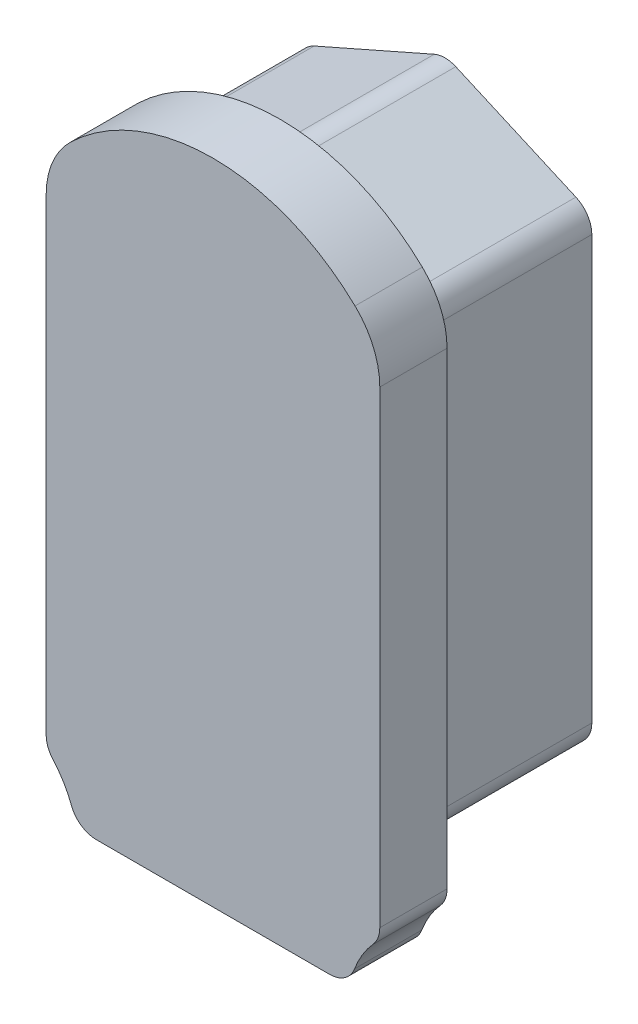
from build123d import *

# Parameters (mm, degrees)
SKICA1_W                 = 12.5
SKICA1_H                 = 24.3
P_IDAT_VYSUNUT_M1_DEPTH  = 4.52
ODEBRAT_VYSUNUT_M1_DEPTH = 4.52
ODEBRAT_VYSUNUT_M2_DEPTH = 4.52
ZAOBLIT1_R               = 1
ZAOBLIT2_R               = 3
P_IDAT_VYSUNUT_M2_DEPTH  = 6.174
ZAOBLIT4_R               = 1
ODEBRAT_VYSUNUT_M3_DEPTH = 2


with BuildPart() as part:
    # Skica1 → Přidat vysunutím1 (new body)
    with BuildSketch(Plane.XY):
        Rectangle(SKICA1_W, SKICA1_H)
    extrude(amount=P_IDAT_VYSUNUT_M1_DEPTH)

    # Skica2 → Odebrat vysunutím1 (cut)
    with BuildSketch(Plane(origin=(0, 0, 0), x_dir=(-1, 0, 0), z_dir=(0, 0, -1))):
        with BuildLine():
            Line((-6.25, 12.15), (-6.25, 8.95))
            ThreePointArc((-6.25, 8.95), (-3.510786949, 11.303490134), (0, 12.15))
            Line((0, 12.15), (-6.25, 12.15))
        make_face()
        with BuildLine():
            Line((6.25, 12.15), (0, 12.15))
            ThreePointArc((0, 12.15), (3.510786949, 11.303490134), (6.25, 8.95))
            Line((6.25, 8.95), (6.25, 12.15))
        make_face()
    extrude(amount=-ODEBRAT_VYSUNUT_M1_DEPTH, mode=Mode.SUBTRACT)

    # Skica3 → Odebrat vysunutím2 (cut)
    with BuildSketch(Plane(origin=(0, 0, 0), x_dir=(-1, 0, 0), z_dir=(0, 0, -1))):
        with BuildLine():
            Line((-6.25, -10.10590929), (-6.25, -12.15))
            Line((-6.25, -12.15), (-5.130314287, -12.15))
            ThreePointArc((-5.130314287, -12.15), (-5.519629341, -11.034545119), (-6.25, -10.10590929))
        make_face()
        with BuildLine():
            Line((6.25, -12.15), (5.130314287, -12.15))
            ThreePointArc((5.130314287, -12.15), (5.519629341, -11.034545119), (6.25, -10.10590929))
            Line((6.25, -10.10590929), (6.25, -12.15))
        make_face()
    extrude(amount=-ODEBRAT_VYSUNUT_M2_DEPTH, mode=Mode.SUBTRACT)

    # Zaoblit1
    zaoblit1_edges = [part.edges().sort_by_distance(p)[0] for p in [
        (6.25, -10.10590929, 2.26),
        (5.130314287, -12.15, 2.26),
        (-5.130314287, -12.15, 2.26),
        (-6.25, -10.10590929, 2.26),
    ]]
    fillet(zaoblit1_edges, radius=ZAOBLIT1_R)

    # Zaoblit2
    zaoblit2_edges = [part.edges().sort_by_distance(p)[0] for p in [
        (6.25, 8.95, 2.26),
        (-6.25, 8.95, 2.26),
    ]]
    fillet(zaoblit2_edges, radius=ZAOBLIT2_R)

    # Skica4 → Přidat vysunutím2 (add)
    with BuildSketch(Plane(origin=(0, 0, 0), x_dir=(-1, 0, 0), z_dir=(0, 0, -1))):
        Polygon((0, 11.15), (-5.5, 8.726822139), (-5.5, -8.426822139), (0, -10.85), (5.5, -8.426822139), (5.5, 8.726822139), align=None)
    extrude(amount=P_IDAT_VYSUNUT_M2_DEPTH)

    # Zaoblit4
    zaoblit4_edges = [part.edges().sort_by_distance(p)[0] for p in [
        (0, -10.85, -3.087),
        (-5.5, -8.426822139, -3.087),
        (-5.5, 8.726822139, -3.087),
        (0, 11.15, -3.087),
        (5.5, 8.726822139, -3.087),
        (5.5, -8.426822139, -3.087),
    ]]
    fillet(zaoblit4_edges, radius=ZAOBLIT4_R)

    # Skica5 → Odebrat vysunutím3 (cut)
    with BuildSketch(Plane.XY.offset(4.52)):
        with BuildLine():
            Line((6.25, -9.69593403), (6.25, 7.846566614))
            ThreePointArc((6.25, 7.846566614), (6.008509797, 9.025813706), (5.322917532, 10.015209717))
            ThreePointArc((5.322917532, 10.015209717), (0, 12.15), (-5.322917532, 10.015209717))
            ThreePointArc((-5.322917532, 10.015209717), (-6.008509797, 9.025813706), (-6.25, 7.846566614))
            Line((-6.25, 7.846566614), (-6.25, -9.69593403))
            ThreePointArc((-6.25, -9.69593403), (-6.183994107, -10.053222441), (-5.994689983, -10.36334457))
            ThreePointArc((-5.994689983, -10.36334457), (-5.597278437, -10.899802086), (-5.306089821, -11.500578079))
            ThreePointArc((-5.306089821, -11.500578079), (-4.939390465, -11.971759721), (-4.369556313, -12.15))
            Line((-4.369556313, -12.15), (4.369556313, -12.15))
            ThreePointArc((4.369556313, -12.15), (4.939390465, -11.971759721), (5.306089821, -11.500578079))
            ThreePointArc((5.306089821, -11.500578079), (5.597278437, -10.899802086), (5.994689983, -10.36334457))
            ThreePointArc((5.994689983, -10.36334457), (6.183994107, -10.053222441), (6.25, -9.69593403))
        make_face()
    extrude(amount=-ODEBRAT_VYSUNUT_M3_DEPTH, mode=Mode.SUBTRACT)


solid = part.part
